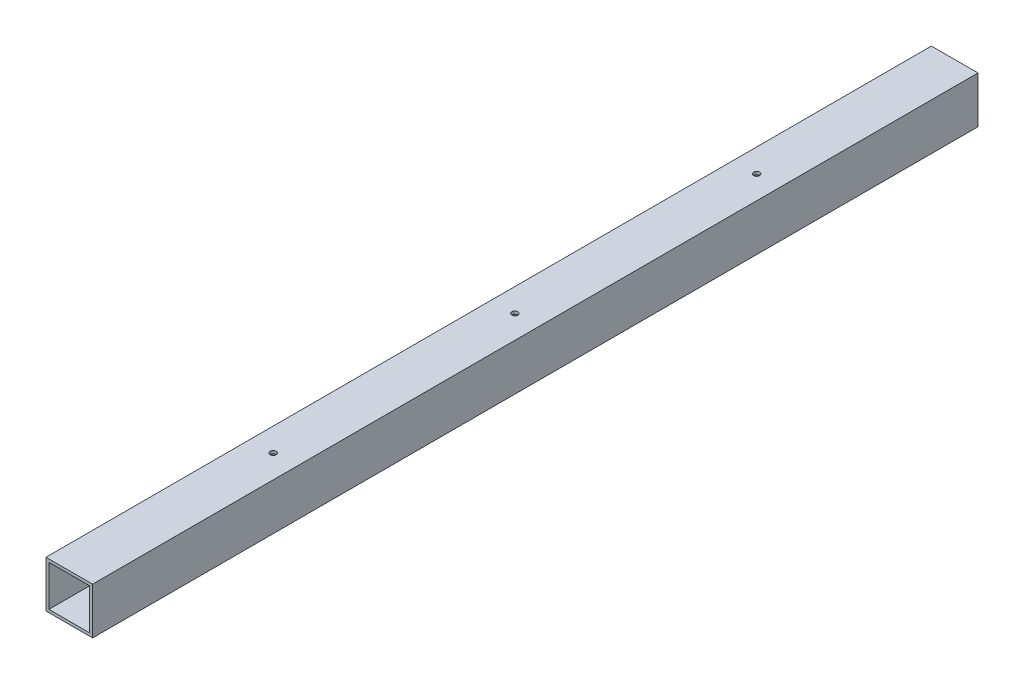
from build123d import *

# Parameters (mm, degrees)
SKETCH1_W           = 50.8
SKETCH1_H           = 50.8
SKETCH1_W_2         = 44.45
SKETCH1_H_2         = 44.45
BOSS_EXTRUDE1_DEPTH = 965.2
SKETCH2_R           = 3.302
CUT_EXTRUDE1_DEPTH  = 967.869608582


with BuildPart() as part:
    # Sketch1 → Boss-Extrude1 (new body)
    with BuildSketch(Plane.XY):
        with Locations((0, 25.4)):
            Rectangle(SKETCH1_W, SKETCH1_H)
        with Locations((0, 25.4)):
            Rectangle(SKETCH1_W_2, SKETCH1_H_2, mode=Mode.SUBTRACT)
    extrude(amount=BOSS_EXTRUDE1_DEPTH)

    # Sketch2 → Cut-Extrude1 (cut, through all)
    with BuildSketch(Plane(origin=(0, 50.8, 0), x_dir=(1, 0, 0), z_dir=(0, 1, 0))):
        with Locations(Location((0, -215.9, 0), (0, 0, 270))):
            Circle(SKETCH2_R)
        with Locations(Location((0, -479.425, 0), (0, 0, 270))):
            Circle(SKETCH2_R)
        with Locations(Location((0, -742.95, 0), (0, 0, 270))):
            Circle(SKETCH2_R)
    extrude(amount=-CUT_EXTRUDE1_DEPTH, mode=Mode.SUBTRACT)


solid = part.part
